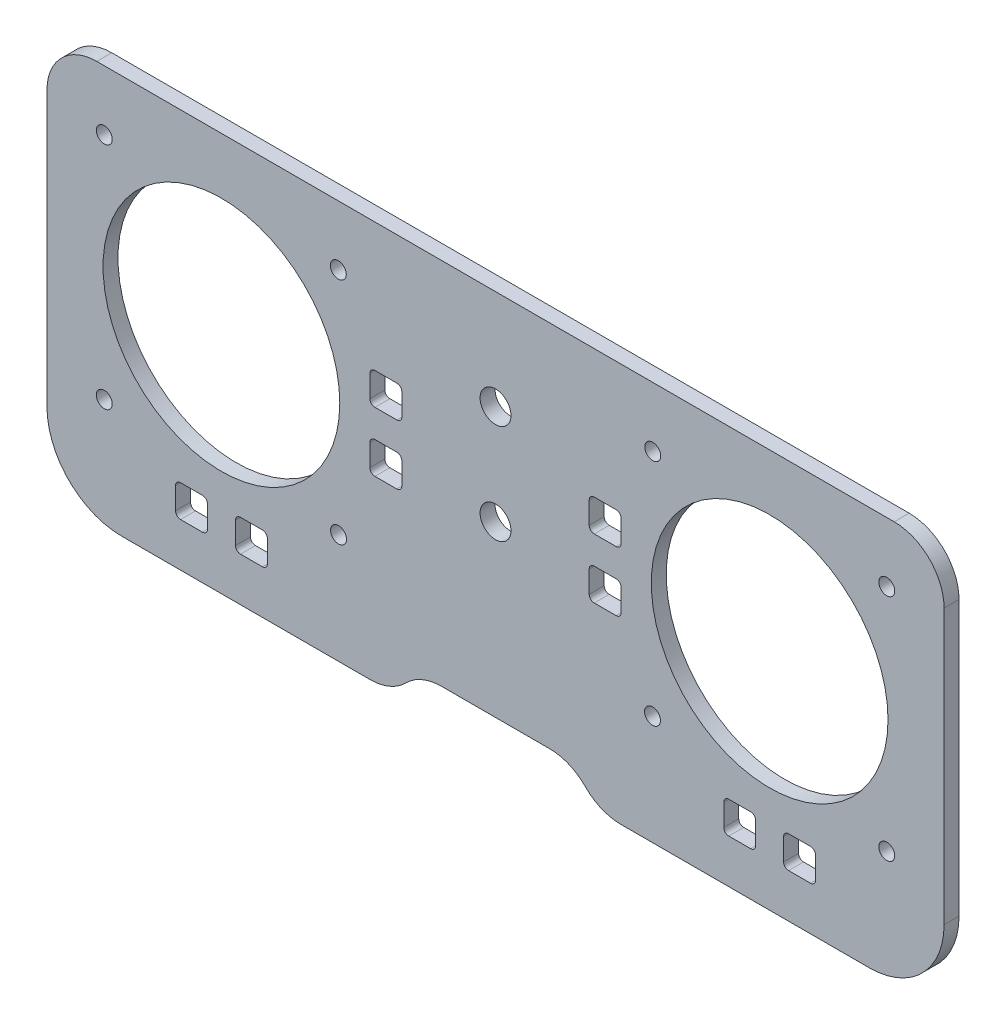
from build123d import *

# Parameters (mm, degrees)
SKETCH1_W           = 180
SKETCH1_H           = 80
SKETCH1_R           = 23.75
BOSS_EXTRUDE1_DEPTH = 3
SKETCH2_W           = 6.4
SKETCH2_H           = 6.4
SKETCH2_W_2         = 6.402436435
CUT_EXTRUDE1_DEPTH  = 99.534258002
CUT_EXTRUDE2_DEPTH  = 3
SKETCH4_R           = 1.6
CUT_EXTRUDE3_DEPTH  = 3
SKETCH7_R           = 3.1
CUT_EXTRUDE4_DEPTH  = 3
FILLET1_R           = 10
FILLET2_R           = 15
FILLET3_R           = 10
FILLET4_R           = 1


with BuildPart() as part:
    # Sketch1 → Boss-Extrude1 (new body)
    with BuildSketch(Plane.XY):
        Rectangle(SKETCH1_W, SKETCH1_H)
        with Locations((55, 5)):
            Circle(SKETCH1_R, mode=Mode.SUBTRACT)
        with Locations((-55, 5)):
            Circle(SKETCH1_R, mode=Mode.SUBTRACT)
    extrude(amount=BOSS_EXTRUDE1_DEPTH)

    # Sketch2 → Cut-Extrude1 (cut, through all)
    with BuildSketch(Plane.XY.offset(3)):
        with Locations((-61, -28)):
            Rectangle(SKETCH2_W, SKETCH2_H)
        with Locations((-48.976364432, -28)):
            Rectangle(SKETCH2_W_2, SKETCH2_H)
        with Locations((-22, -1)):
            Rectangle(SKETCH2_W, SKETCH2_H)
        with Locations((-22, 11)):
            Rectangle(SKETCH2_W, SKETCH2_H)
        with Locations((22, -1)):
            Rectangle(SKETCH2_W, SKETCH2_H)
        with Locations((22, 11)):
            Rectangle(SKETCH2_W, SKETCH2_H)
        with Locations((49, -28)):
            Rectangle(SKETCH2_W, SKETCH2_H)
        with Locations((61, -28)):
            Rectangle(SKETCH2_W, SKETCH2_H)
    extrude(amount=-CUT_EXTRUDE1_DEPTH, mode=Mode.SUBTRACT)

    # Sketch3 → Cut-Extrude2 (cut)
    with BuildSketch(Plane.XY.offset(3)):
        Polygon((-21, -40), (-15, -34), (15, -34), (21, -40), align=None)
    extrude(amount=-CUT_EXTRUDE2_DEPTH, mode=Mode.SUBTRACT)

    # Sketch4 → Cut-Extrude3 (cut)
    with BuildSketch(Plane.XY.offset(3)):
        with Locations((-78.5, 28)):
            Circle(SKETCH4_R)
        with Locations((-31.545874822, 28)):
            Circle(SKETCH4_R)
        with Locations((-31.5, -18)):
            Circle(SKETCH4_R)
        with Locations((-78.5, -18)):
            Circle(SKETCH4_R)
        with Locations(Location((31.5, -18, 0), (0, 0, 180))):
            Circle(SKETCH4_R)
        with Locations(Location((31.545874822, 28, 0), (0, 0, 180))):
            Circle(SKETCH4_R)
        with Locations(Location((78.5, 28, 0), (0, 0, 180))):
            Circle(SKETCH4_R)
        with Locations(Location((78.5, -18, 0), (0, 0, 180))):
            Circle(SKETCH4_R)
    extrude(amount=-CUT_EXTRUDE3_DEPTH, mode=Mode.SUBTRACT)

    # Sketch7 → Cut-Extrude4 (cut)
    with BuildSketch(Plane.XY.offset(3)):
        Circle(SKETCH7_R)
        with Locations((0, 20)):
            Circle(SKETCH7_R)
    extrude(amount=-CUT_EXTRUDE4_DEPTH, mode=Mode.SUBTRACT)

    # Fillet1
    fillet1_edges = [part.edges().sort_by_distance(p)[0] for p in [
        (-90, 40, 1.5),
        (90, 40, 1.5),
    ]]
    fillet(fillet1_edges, radius=FILLET1_R)

    # Fillet2
    fillet2_edges = [part.edges().sort_by_distance(p)[0] for p in [
        (90, -40, 1.5),
        (-90, -40, 1.5),
    ]]
    fillet(fillet2_edges, radius=FILLET2_R)

    # Fillet3
    fillet3_edges = [part.edges().sort_by_distance(p)[0] for p in [
        (-15, -34, 1.5),
        (15, -34, 1.5),
        (21, -40, 1.5),
        (-21, -40, 1.5),
    ]]
    fillet(fillet3_edges, radius=FILLET3_R)

    # Fillet4
    fillet4_edges = [part.edges().sort_by_distance(p)[0] for p in [
        (45.8, -31.2, 1.5),
        (45.8, -24.8, 1.5),
        (52.2, -24.8, 1.5),
        (52.2, -31.2, 1.5),
        (57.8, -31.2, 1.5),
        (57.8, -24.8, 1.5),
        (64.2, -24.8, 1.5),
        (64.2, -31.2, 1.5),
        (-64.2, -24.8, 1.5),
        (-57.8, -24.8, 1.5),
        (-57.8, -31.2, 1.5),
        (-64.2, -31.2, 1.5),
        (-52.177582649, -31.2, 1.5),
        (-52.177582649, -24.8, 1.5),
        (-45.775146214, -24.8, 1.5),
        (-45.775146214, -31.2, 1.5),
        (-25.2, -4.2, 1.5),
        (-25.2, 2.2, 1.5),
        (-18.8, 2.2, 1.5),
        (-18.8, -4.2, 1.5),
        (-25.2, 7.8, 1.5),
        (-25.2, 14.2, 1.5),
        (-18.8, 14.2, 1.5),
        (-18.8, 7.8, 1.5),
        (18.8, -4.2, 1.5),
        (18.8, 2.2, 1.5),
        (25.2, 2.2, 1.5),
        (25.2, -4.2, 1.5),
        (18.8, 7.8, 1.5),
        (18.8, 14.2, 1.5),
        (25.2, 14.2, 1.5),
        (25.2, 7.8, 1.5),
    ]]
    fillet(fillet4_edges, radius=FILLET4_R)


solid = part.part
